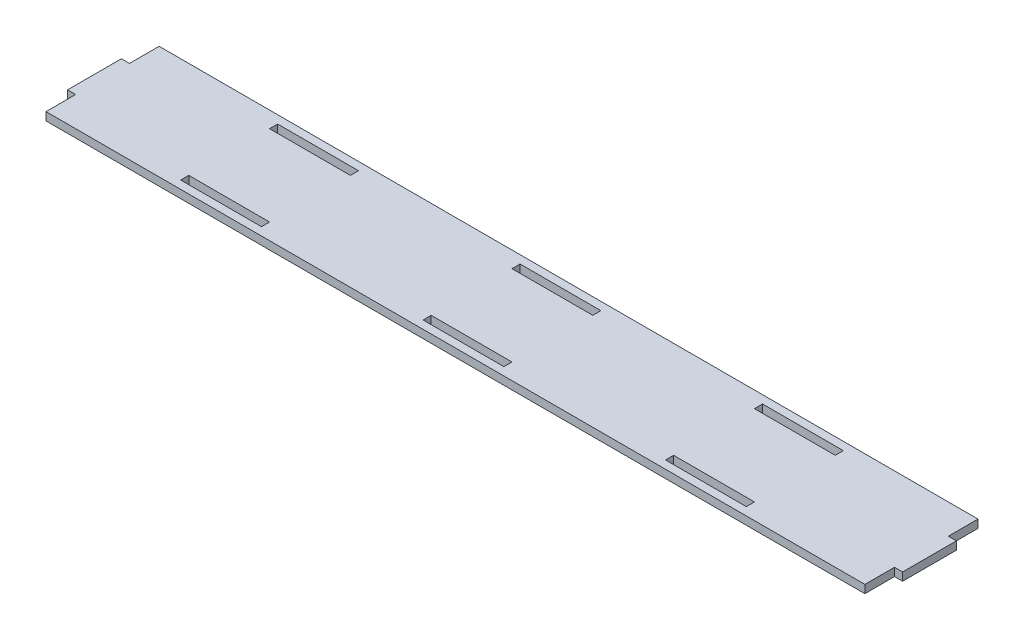
from build123d import *

# Parameters (mm, degrees)
SKETCH1_W           = 30
SKETCH1_H           = 3
BOSS_EXTRUDE1_DEPTH = 3


with BuildPart() as part:
    # Sketch1 → Boss-Extrude1 (new body)
    with BuildSketch(Plane(origin=(0, 0, 0), x_dir=(1, 0, 0), z_dir=(0, 1, 0))):
        Polygon((0, 0), (304, 0), (304, 11), (307, 11), (307, 31), (304, 31), (304, 42), (0, 42), (0, 31), (-3, 31), (-3, 11), (0, 11), align=None)
        with Locations((62, 4.5)):
            Rectangle(SKETCH1_W, SKETCH1_H, mode=Mode.SUBTRACT)
        with Locations((152, 4.5)):
            Rectangle(SKETCH1_W, SKETCH1_H, mode=Mode.SUBTRACT)
        with Locations((242, 4.5)):
            Rectangle(SKETCH1_W, SKETCH1_H, mode=Mode.SUBTRACT)
        with Locations((242, 37.5)):
            Rectangle(SKETCH1_W, SKETCH1_H, mode=Mode.SUBTRACT)
        with Locations((152, 37.5)):
            Rectangle(SKETCH1_W, SKETCH1_H, mode=Mode.SUBTRACT)
        with Locations((62, 37.5)):
            Rectangle(SKETCH1_W, SKETCH1_H, mode=Mode.SUBTRACT)
    extrude(amount=BOSS_EXTRUDE1_DEPTH)


solid = part.part
